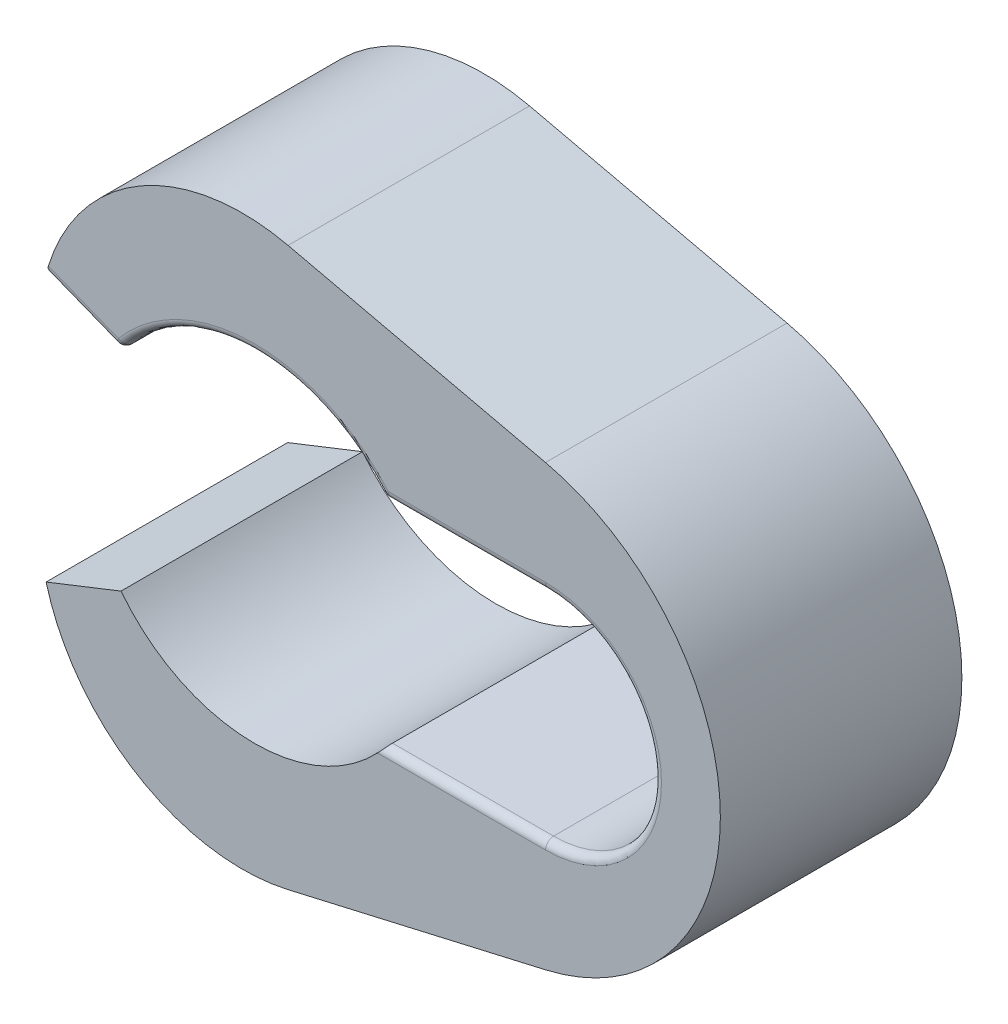
from build123d import *

# Parameters (mm, degrees)
BOSS_EXTRU_1_DEPTH = 15
CONG_1_R           = 0.5


with BuildPart() as part:
    # Esquisse1 → Boss.-Extru.1 (new body)
    with BuildSketch(Plane.XY):
        with BuildLine():
            Line((8.084553173, 6.7), (18.084553173, 6.7))
            ThreePointArc((18.084553173, 6.7), (24.784553173, 0), (18.084553173, -6.7))
            Line((18.084553173, -6.7), (8.084553173, -6.7))
            ThreePointArc((8.084553173, -6.7), (-0.157024945, -10.498825799), (-8.281308366, -6.45522515))
            Line((-8.281308366, -6.45522515), (-12.931761957, -8.291874654))
            ThreePointArc((-12.931761957, -8.291874654), (-7.243702669, -15.843181093), (2.093196436, -17.325936129))
            Line((2.093196436, -17.325936129), (18.084553173, -13.642820952))
            ThreePointArc((18.084553173, -13.642820952), (28.942350685, 0), (18.084553173, 13.642820952))
            Line((18.084553173, 13.642820952), (2.093196436, 17.325936129))
            ThreePointArc((2.093196436, 17.325936129), (-7.243702669, 15.843181093), (-12.931761957, 8.291874654))
            Line((-12.931761957, 8.291874654), (-8.281308366, 6.45522515))
            ThreePointArc((-8.281308366, 6.45522515), (-0.157024945, 10.498825799), (8.084553173, 6.7))
        make_face()
    extrude(amount=BOSS_EXTRU_1_DEPTH)

    # Congé1
    cong_1_edges = [part.edges().sort_by_distance(p)[0] for p in [
        (24.784553173, 0, 15),
        (24.784553173, 0, 0),
        (13.084553173, 6.7, 15),
        (13.084553173, 6.7, 0),
        (-10.606535162, 7.373549902, 15),
        (-10.606535162, 7.373549902, 0),
        (-8.281308366, 6.45522515, 7.5),
        (-0.157024945, 10.498825799, 15),
        (8.084553173, 6.7, 7.5),
        (-0.157024945, 10.498825799, 0),
        (13.084553173, -6.7, 15),
        (13.084553173, -6.7, 0),
        (-12.931761957, 8.291874654, 7.5),
    ]]
    fillet(cong_1_edges, radius=CONG_1_R)


solid = part.part
